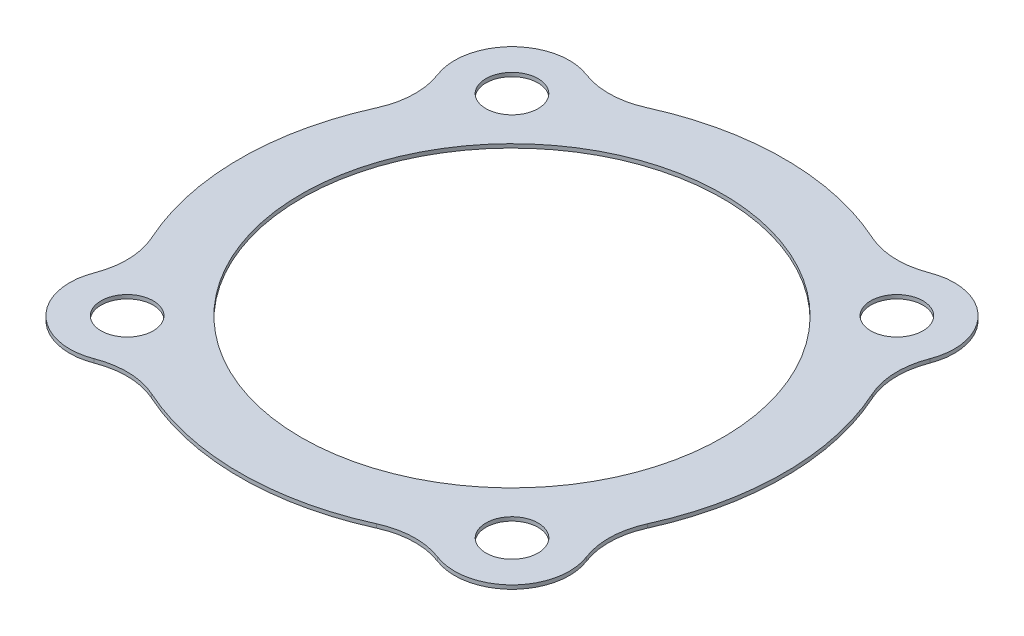
from build123d import *

# Parameters (mm, degrees)
SKETCH1_R                = 45.085
BASE_EXTRUDE_DEPTH       = 0.635
SKETCH2_R                = 34.925
BASE_CUT_DEPTH           = 64.762980443
SKETCH3_R                = 9.525
CORNER_EXTRUDE_DEPTH     = 0.635
SKETCH4_R                = 4.318
CORNER_CUT_DEPTH         = 64.762980443
FILLET_2_R               = 12.7
CIRPATTERN_COUNT         = 4
FILLET_2_OF_CIRPATTERN_R = 12.7


with BuildPart() as part:
    # Sketch1 → Base Extrude (new body)
    with BuildSketch(Plane(origin=(0, 0, 0), x_dir=(1, 0, 0), z_dir=(0, 1, 0))):
        with Locations(Location((0, 0, 0), (0, 0, 270))):
            Circle(SKETCH1_R)
    extrude(amount=BASE_EXTRUDE_DEPTH)

    # Sketch2 → Base Cut (cut, through all)
    with BuildSketch(Plane(origin=(0, 0.635, 0), x_dir=(1, 0, 0), z_dir=(0, 1, 0))):
        with Locations(Location((0, 0, 0), (0, 0, 270))):
            Circle(SKETCH2_R)
    extrude(amount=-BASE_CUT_DEPTH, mode=Mode.SUBTRACT)

    # Sketch3 → Corner Extrude (add)
    with BuildSketch(Plane(origin=(0, 0.635, 0), x_dir=(1, 0, 0), z_dir=(0, 1, 0))):
        with Locations((-31.87990923, 31.87990923)):
            Circle(SKETCH3_R)
    corner_extrude = extrude(amount=-CORNER_EXTRUDE_DEPTH)

    # Sketch4 → Corner Cut (cut, through all)
    with BuildSketch(Plane(origin=(0, 0.635, 0), x_dir=(1, 0, 0), z_dir=(0, 1, 0))):
        with Locations(Location((-31.87990923, 31.87990923, 0), (0, 0, 270))):
            Circle(SKETCH4_R)
    corner_cut = extrude(amount=-CORNER_CUT_DEPTH, mode=Mode.SUBTRACT)

    # Fillet 2
    fillet_2_edges = [part.edges().sort_by_distance(p)[0] for p in [
        (-24.470935923, 0.3175, -37.86595463),
        (-37.86595463, 0.3175, -24.470935923),
    ]]
    fillet(fillet_2_edges, radius=FILLET_2_R)

    # CirPattern: Corner Extrude, Corner Cut ×4 about axis
    cirpattern_axis = Axis((0, 0, 0), (0, 1, 0))
    add([corner_extrude.rotate(cirpattern_axis, i * 360 / CIRPATTERN_COUNT) for i in range(1, CIRPATTERN_COUNT)])
    add([corner_cut.rotate(cirpattern_axis, i * 360 / CIRPATTERN_COUNT) for i in range(1, CIRPATTERN_COUNT)], mode=Mode.SUBTRACT)

    # Fillet 2 of CirPattern
    fillet_2_of_cirpattern_edges = [part.edges().sort_by_distance(p)[0] for p in [
        (-37.86595463, 0.3175, 24.470935923),
        (-24.470935923, 0.3175, 37.86595463),
        (24.470935923, 0.3175, 37.86595463),
        (37.86595463, 0.3175, 24.470935923),
        (37.86595463, 0.3175, -24.470935923),
        (24.470935923, 0.3175, -37.86595463),
    ]]
    fillet(fillet_2_of_cirpattern_edges, radius=FILLET_2_OF_CIRPATTERN_R)


solid = part.part
